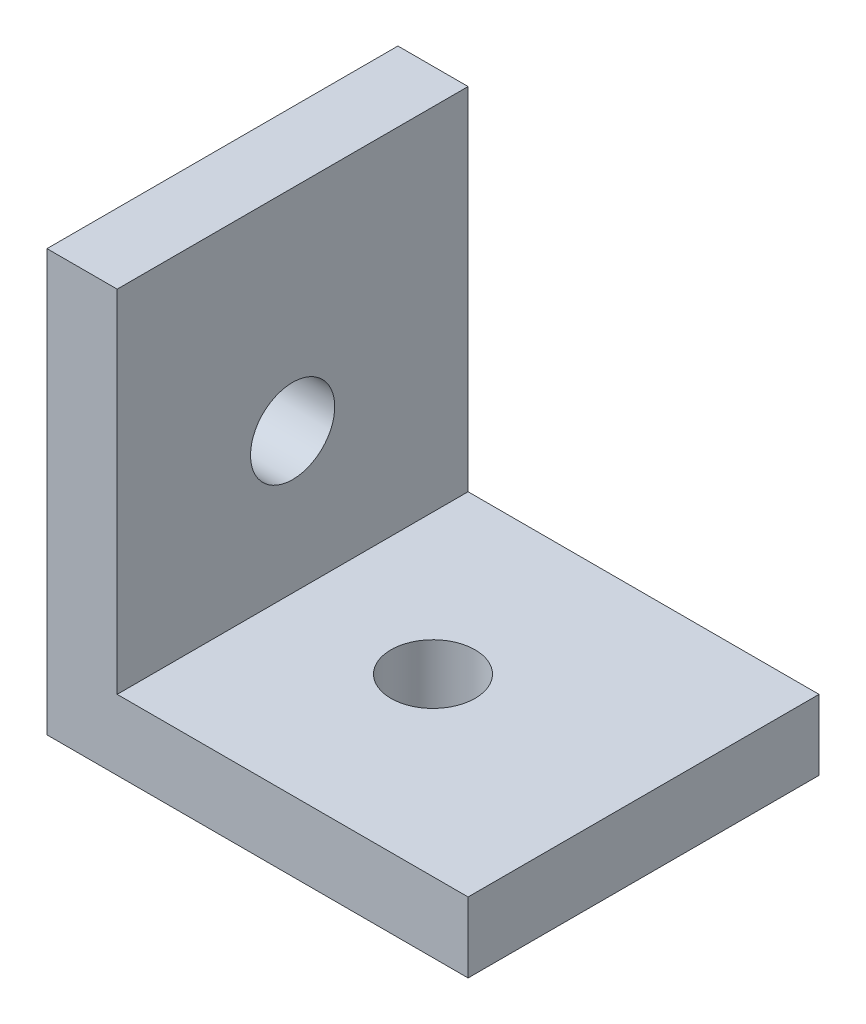
from build123d import *

# Parameters (mm, degrees)
BOSS_EXTRUDE1_DEPTH = 12.5
SKETCH2_R           = 3
CUT_EXTRUDE1_DEPTH  = 45.229515032
SKETCH3_R           = 3
CUT_EXTRUDE2_DEPTH  = 45.229515032


with BuildPart() as part:
    # Sketch1 → Boss-Extrude1 (new, symmetric)
    with BuildSketch(Plane.XY):
        Polygon((0, 0), (0, 30), (5, 30), (5, 5), (30, 5), (30, 0), align=None)
    extrude(amount=BOSS_EXTRUDE1_DEPTH, both=True)

    # Sketch2 → Cut-Extrude1 (cut, through all)
    with BuildSketch(Plane.ZY):
        with Locations((0, 15)):
            Circle(SKETCH2_R)
    extrude(amount=-CUT_EXTRUDE1_DEPTH, mode=Mode.SUBTRACT)

    # Sketch3 → Cut-Extrude2 (cut, through all)
    with BuildSketch(Plane(origin=(0, 0, 0), x_dir=(0, 0, 1), z_dir=(0, -1, 0))):
        with Locations(Location((0, -15, 0), (0, 0, 270))):
            Circle(SKETCH3_R)
    extrude(amount=-CUT_EXTRUDE2_DEPTH, mode=Mode.SUBTRACT)


solid = part.part
